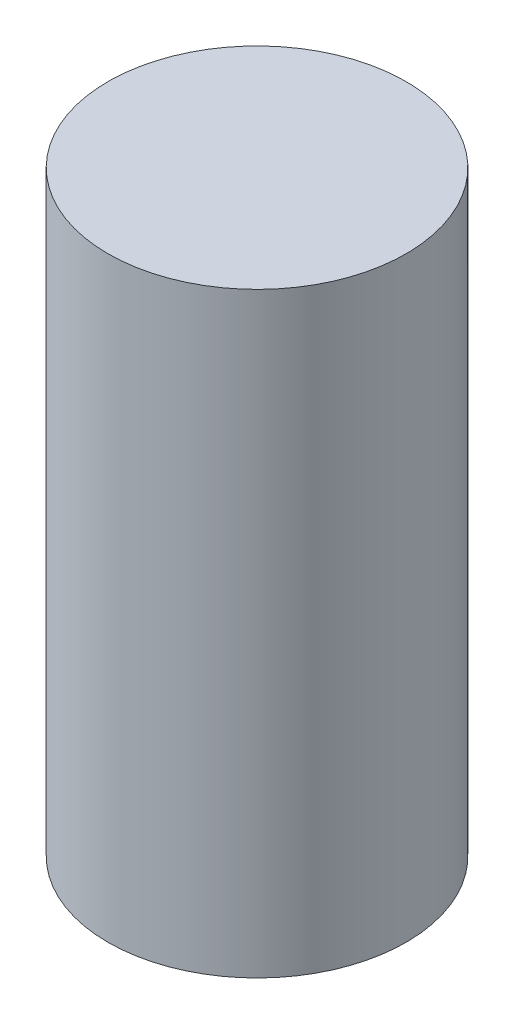
from build123d import *

# Parameters (mm, degrees)
SKETCH_1_R          = 10
EXTRUDE_1_DEPTH     = 40
SKETCH_2_R          = 2.5
CUT_EXTRUDE_1_DEPTH = 40


with BuildPart() as part:
    # 草图1 → 凸台-拉伸1 (new body)
    with BuildSketch(Plane(origin=(0, 0, 0), x_dir=(1, 0, 0), z_dir=(0, 1, 0))):
        with Locations(Location((0, 0, 0), (0, 0, 270))):
            Circle(SKETCH_1_R)
    extrude(amount=EXTRUDE_1_DEPTH)

    # 草图2 → 切除-拉伸1 (cut)
    with BuildSketch(Plane.XY):
        with Locations((0, 30)):
            Circle(SKETCH_2_R)
        with Locations((0, 10)):
            Circle(SKETCH_2_R)
    extrude(amount=-CUT_EXTRUDE_1_DEPTH, mode=Mode.SUBTRACT)


solid = part.part
